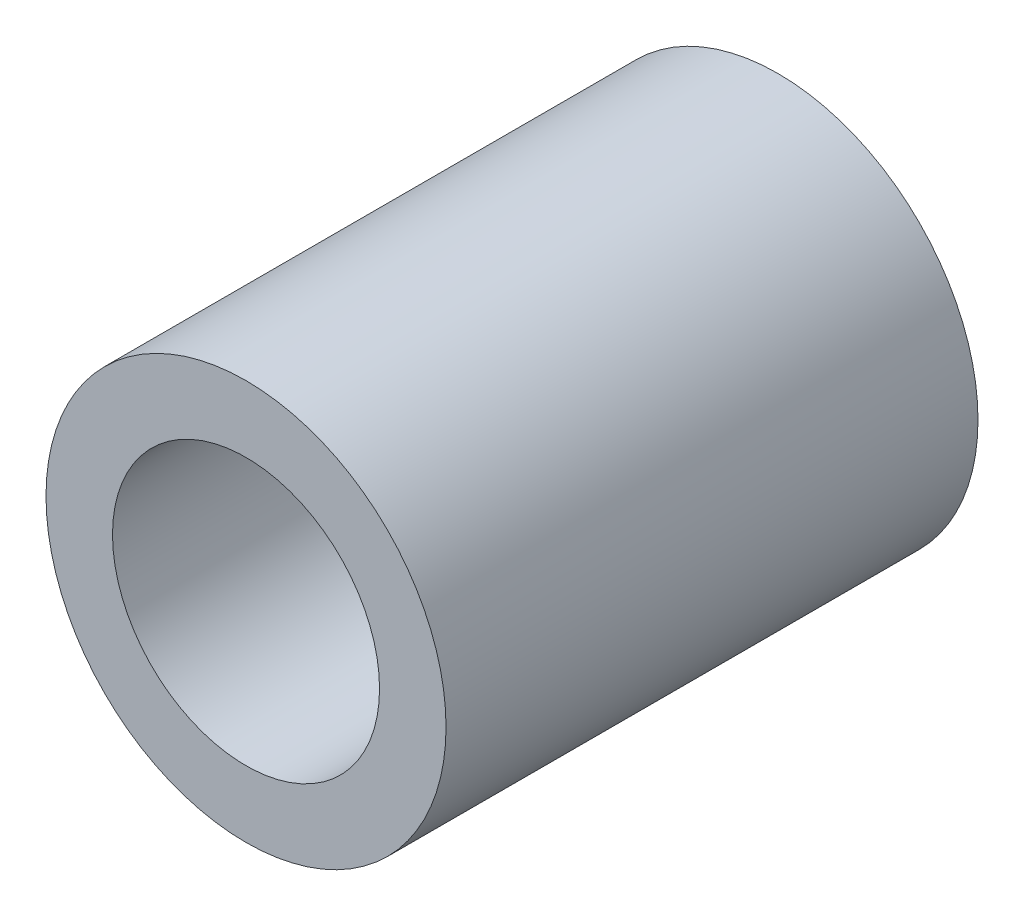
from build123d import *

# Parameters (mm, degrees)
SKETCH1_R      = 4.7752
SKETCH1_R_2    = 3.1877
EXTRUDE1_DEPTH = 6.35


with BuildPart() as part:
    # Sketch1 → Extrude1 (new, symmetric)
    with BuildSketch(Plane.XY):
        Circle(SKETCH1_R)
        Circle(SKETCH1_R_2, mode=Mode.SUBTRACT)
    extrude(amount=EXTRUDE1_DEPTH, both=True)


solid = part.part
